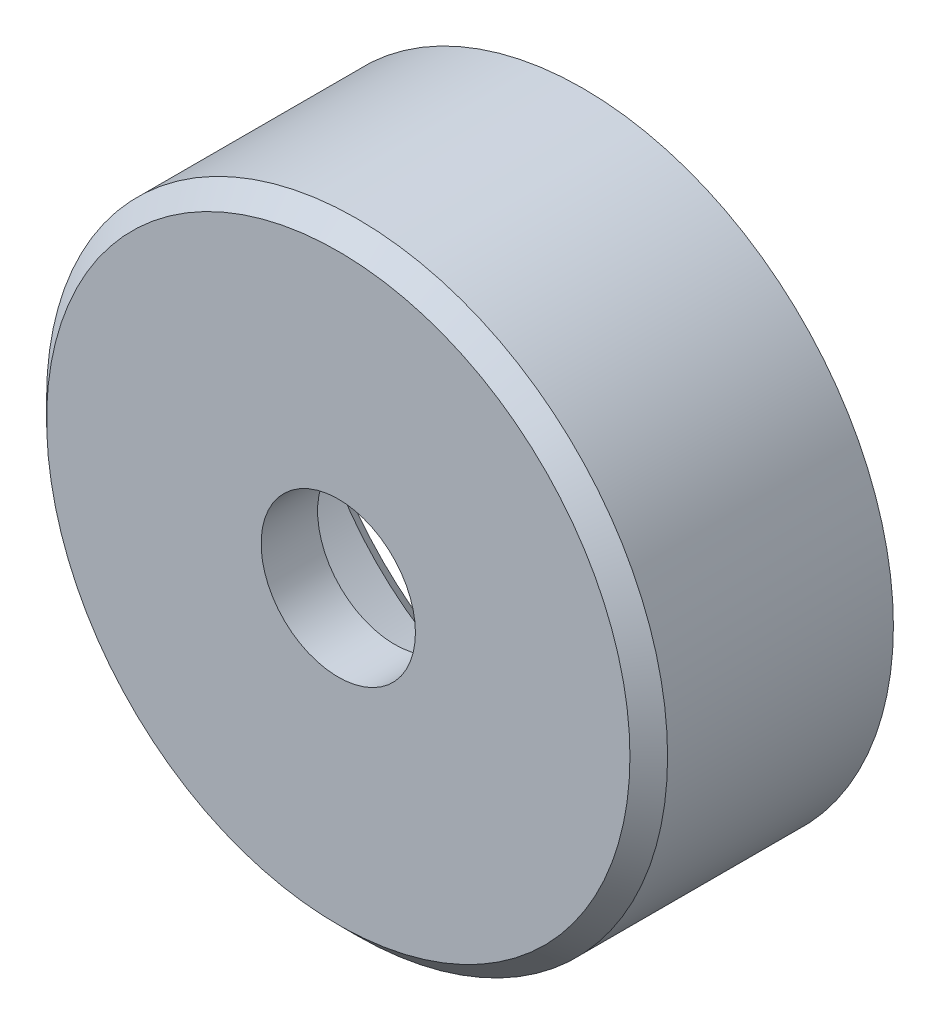
from build123d import *

# Parameters (mm, degrees)
ESQUISSE1_R                  = 16.5
ESQUISSE1_R_2                = 14
BOSS_EXTRU_1_DEPTH           = 10
ESQUISSE2_R                  = 16.5
BOSS_EXTRU_2_DEPTH           = 3
CHANFREIN1_SIZE              = 1
ENL_V_MAT_EXTRU_1_DEPTH      = 27.711420778
ENL_V_MAT_EXTRU_1_DEPTH_BACK = 27.711420778
ESQUISSE3_R                  = 4.1
CHANFREIN2_SIZE              = 1


with BuildPart() as part:
    # Esquisse1 → Boss.-Extru.1 (new body)
    with BuildSketch(Plane.XY):
        Circle(ESQUISSE1_R)
        Circle(ESQUISSE1_R_2, mode=Mode.SUBTRACT)
    extrude(amount=BOSS_EXTRU_1_DEPTH)

    # Esquisse2 → Boss.-Extru.2 (add)
    with BuildSketch(Plane.XY.offset(10)):
        Circle(ESQUISSE2_R)
    extrude(amount=BOSS_EXTRU_2_DEPTH)

    # Chanfrein1
    chanfrein1_edges = [part.edges().sort_by_distance(p)[0] for p in [
        (-14, 0, 0),
    ]]
    chamfer(chanfrein1_edges, length=CHANFREIN1_SIZE)

    # Esquisse3 → Enlèv. mat.-Extru.1 (cut, two sides: drawn at the far end of the back side and taken through both)
    with BuildSketch(Plane.XY.offset(13).offset(-ENL_V_MAT_EXTRU_1_DEPTH_BACK)):
        Circle(ESQUISSE3_R)
    extrude(amount=ENL_V_MAT_EXTRU_1_DEPTH + ENL_V_MAT_EXTRU_1_DEPTH_BACK, mode=Mode.SUBTRACT)

    # Chanfrein2
    chanfrein2_edges = [part.edges().sort_by_distance(p)[0] for p in [
        (-16.5, 0, 13),
    ]]
    chamfer(chanfrein2_edges, length=CHANFREIN2_SIZE)


solid = part.part
